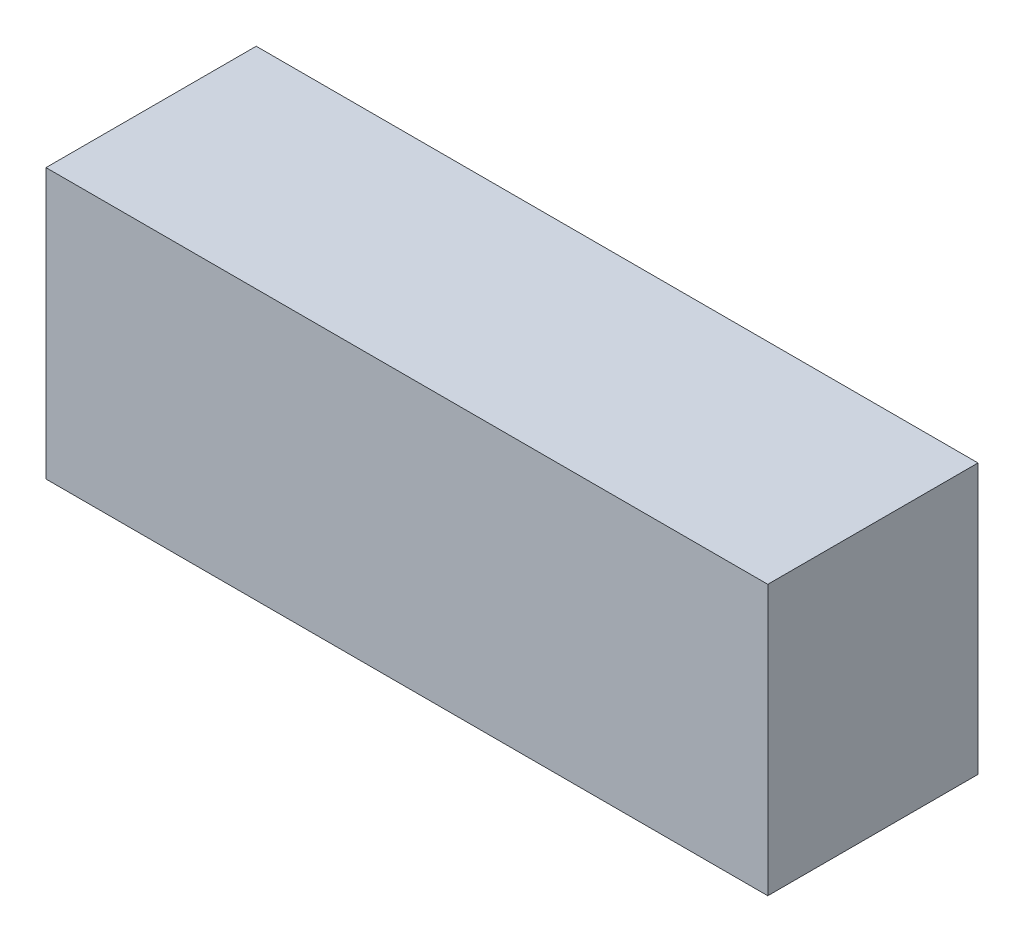
from build123d import *

# Parameters (mm, degrees)
SKETCH_1_W      = 194
SKETCH_1_H      = 72.5
EXTRUDE_1_DEPTH = 56.5


with BuildPart() as part:
    # 草图1 → 凸台-拉伸1 (new body)
    with BuildSketch(Plane.XY):
        with Locations((97, 36.25)):
            Rectangle(SKETCH_1_W, SKETCH_1_H)
    extrude(amount=EXTRUDE_1_DEPTH)


solid = part.part
